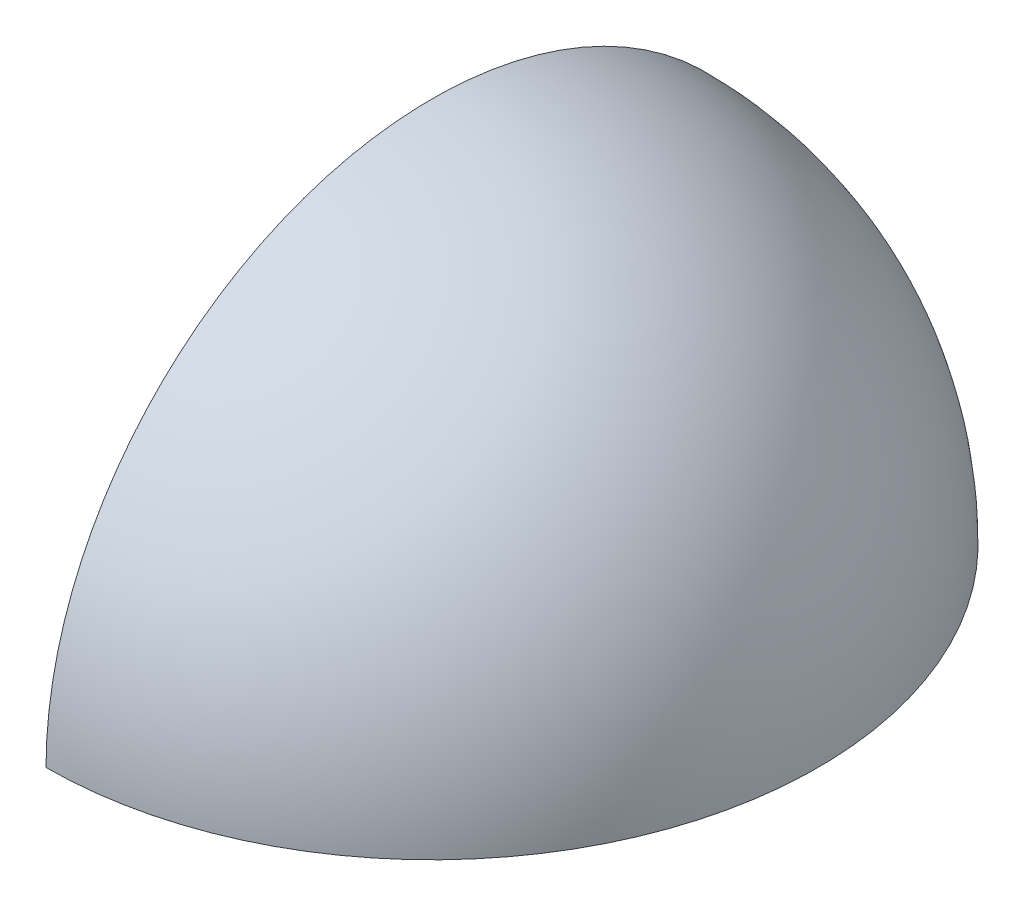
from build123d import *

# Parameters (mm, degrees)
REVOLVE1_ANGLE = 90


with BuildPart() as part:
    # Sketch1 → Revolve1 (revolve)
    with BuildSketch(Plane(origin=(0, 0, 0), x_dir=(1, 0, 0), z_dir=(0, 1, 0))):
        with BuildLine():
            Line((0, 19.05), (0, -19.05))
            ThreePointArc((0, -19.05), (19.05, 0), (0, 19.05))
        make_face()
    revolve(axis=Axis((0, 0, -19.05), (0, 0, 1)), revolution_arc=REVOLVE1_ANGLE)


solid = part.part
